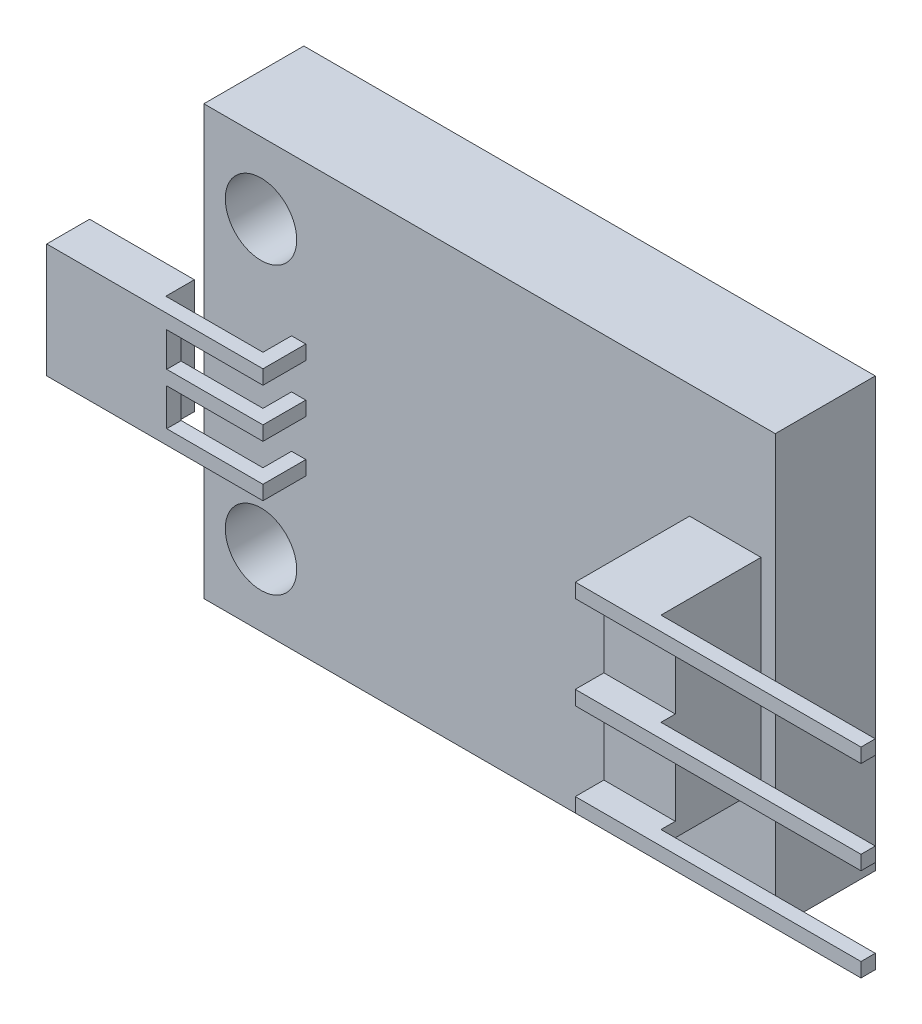
from build123d import *

# Parameters (mm, degrees)
SKETCH1_W           = 20
SKETCH1_H           = 15
BOSS_EXTRUDE1_DEPTH = 3.5
BOSS_EXTRUDE8_DEPTH = 1.5
SKETCH3_W           = 3.4
SKETCH3_H           = 1
CUT_EXTRUDE1_DEPTH  = 18.642278764
SKETCH4_W           = 10
SKETCH4_H           = 7
BOSS_EXTRUDE9_DEPTH = 4
SKETCH5_W           = 7.5
SKETCH5_H           = 3.5
CUT_EXTRUDE2_DEPTH  = 22.592822882
CUT_EXTRUDE3_DEPTH  = 1
SKETCH7_R           = 1.25
CUT_EXTRUDE4_DEPTH  = 21.03746491


with BuildPart() as part:
    # Sketch1 → Boss-Extrude1 (new body)
    with BuildSketch(Plane.XY):
        Rectangle(SKETCH1_W, SKETCH1_H)
    extrude(amount=BOSS_EXTRUDE1_DEPTH)

    # Sketch2 → Boss-Extrude8 (add)
    with BuildSketch(Plane.XY.offset(3.5)):
        Polygon((-6.431580724, 2), (-10, 2), (-10, 1.5), (-10, 0.3), (-10, -2), (-6.431580724, -2), (-6.431580724, -1.5), (-9.8, -1.5), (-9.8, -0.2), (-6.431580724, -0.2), (-6.431580724, 0.3), (-9.8, 0.3), (-9.8, 1.5), (-6.431580724, 1.5), align=None)
        Polygon((-10, 1.5), (-10, 2), (-14, 2), (-14, -2), (-10, -2), (-10, 0.3), align=None)
    extrude(amount=BOSS_EXTRUDE8_DEPTH)

    # Sketch3 → Cut-Extrude1 (cut, through all)
    with BuildSketch(Plane.XZ.offset(2)):
        with Locations((-8.631580724, 4)):
            Rectangle(SKETCH3_W, SKETCH3_H)
    extrude(amount=-CUT_EXTRUDE1_DEPTH, mode=Mode.SUBTRACT)

    # Sketch4 → Boss-Extrude9 (add)
    with BuildSketch(Plane.XY.offset(3.5)):
        with Locations((12, 0)):
            Rectangle(SKETCH4_W, SKETCH4_H)
    extrude(amount=BOSS_EXTRUDE9_DEPTH)

    # Sketch5 → Cut-Extrude2 (cut, through all)
    with BuildSketch(Plane.XZ.offset(3.5)):
        with Locations((13.25, 5.25)):
            Rectangle(SKETCH5_W, SKETCH5_H)
    extrude(amount=-CUT_EXTRUDE2_DEPTH, mode=Mode.SUBTRACT)

    # Sketch6 → Cut-Extrude3 (cut)
    with BuildSketch(Plane.XY.offset(7.5)):
        Polygon((17, 3), (6, 3), (6, 0.25), (17, 0.25), (17, -0.25), (6, -0.25), (6, -3), (17, -3), (18, -3), (18, 3), align=None)
    extrude(amount=-CUT_EXTRUDE3_DEPTH, mode=Mode.SUBTRACT)

    # Sketch7 → Cut-Extrude4 (cut, through all)
    with BuildSketch(Plane(origin=(0, 0, 0), x_dir=(-1, 0, 0), z_dir=(0, 0, -1))):
        with Locations((8, -5)):
            Circle(SKETCH7_R)
        with Locations((8, 5)):
            Circle(SKETCH7_R)
    extrude(amount=-CUT_EXTRUDE4_DEPTH, mode=Mode.SUBTRACT)


solid = part.part
